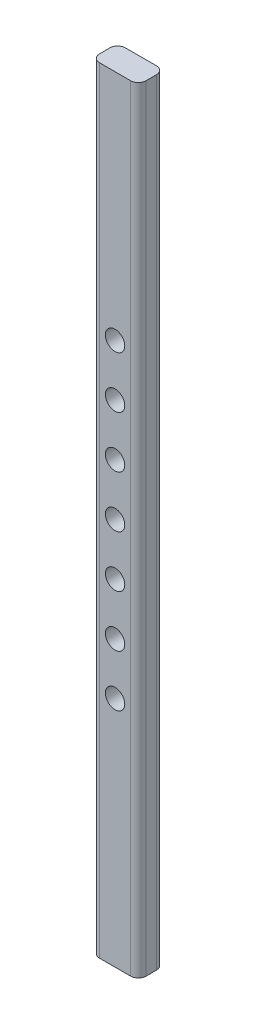
from build123d import *

# Parameters (mm, degrees)
CROQUIS1_W              = 18
CROQUIS1_H              = 300
SALIENTE_EXTRUIR1_DEPTH = 5
REDONDEO2_R             = 3
CROQUIS2_R              = 3.747917417
CORTAR_EXTRUIR1_DEPTH   = 10


with BuildPart() as part:
    # Croquis1 → Saliente-Extruir1 (new, symmetric)
    with BuildSketch(Plane.XY):
        Rectangle(CROQUIS1_W, CROQUIS1_H)
    extrude(amount=SALIENTE_EXTRUIR1_DEPTH, both=True)

    # Redondeo2
    redondeo2_edges = [part.edges().sort_by_distance(p)[0] for p in [
        (-9, 0, 5),
        (9, 0, 5),
        (-9, 0, -5),
        (9, 0, -5),
    ]]
    fillet(redondeo2_edges, radius=REDONDEO2_R)

    # Croquis2 → Cortar-Extruir1 (cut)
    with BuildSketch(Plane.XY.offset(5)):
        Circle(CROQUIS2_R)
        with Locations((0, 20)):
            Circle(CROQUIS2_R)
        with Locations((0, 40)):
            Circle(CROQUIS2_R)
        with Locations((0, 60)):
            Circle(CROQUIS2_R)
        with Locations((0, -20)):
            Circle(CROQUIS2_R)
        with Locations((0, -60)):
            Circle(CROQUIS2_R)
        with Locations((0, -40)):
            Circle(CROQUIS2_R)
    extrude(amount=-CORTAR_EXTRUIR1_DEPTH, mode=Mode.SUBTRACT)


solid = part.part
